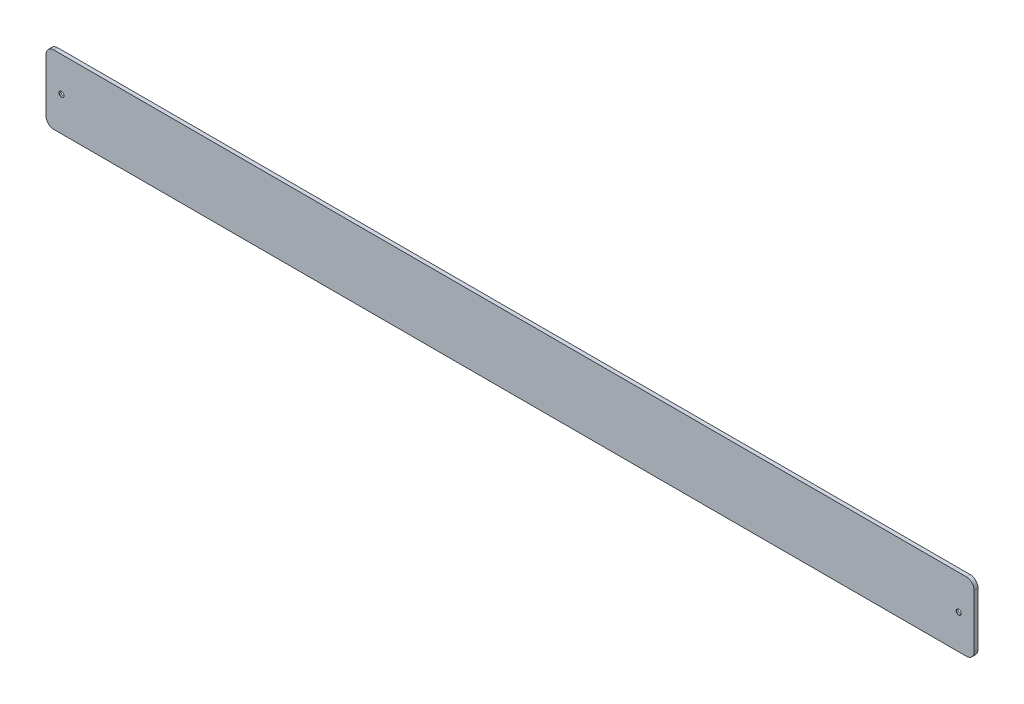
from build123d import *

# Parameters (mm, degrees)
BOSS_EXTRU_1_DEPTH                         = 5
D_GAGEMENT_M61_D                           = 6.6
CHAMBRAGE_POUR_VIS_T_TE_RONDE_BOMB_2_COUNT = 2
CHAMBRAGE_POUR_VIS_T_TE_RONDE_BOMB_2_PITCH = 1160.000013464


with BuildPart() as part:
    # Esquisse1 → Boss.-Extru.1 (new body)
    with BuildSketch(Plane.XY):
        with BuildLine():
            Line((-1067.280483871, -44.5), (112.719516129, -44.5))
            ThreePointArc((112.719516129, -44.5), (119.790583941, -41.571067812), (122.719516129, -34.5))
            Line((122.719516129, -34.5), (122.719516129, 34.5))
            ThreePointArc((122.719516129, 34.5), (119.790583941, 41.571067812), (112.719516129, 44.5))
            Line((112.719516129, 44.5), (-1067.280483871, 44.5))
            ThreePointArc((-1067.280483871, 44.5), (-1074.351551683, 41.571067812), (-1077.280483871, 34.5))
            Line((-1077.280483871, 34.5), (-1077.280483871, -34.5))
            ThreePointArc((-1077.280483871, -34.5), (-1074.351551683, -41.571067812), (-1067.280483871, -44.5))
        make_face()
    extrude(amount=BOSS_EXTRU_1_DEPTH)

    # Dégagement M61 (through all)
    with Locations(Plane.XY.offset(5)):
        with Locations((-1057.280483871, -0.176736788), (102.719516129, 0)):
            Hole(D_GAGEMENT_M61_D / 2)

    # Esquisse4 → Chambrage pour vis à tête ronde bombée M61 (revolve, cut)
    with BuildSketch(Plane.YZ.offset(102.719516129)):
        Polygon((0, 0), (0, 5), (3.3, 5), (3.3, 4.625), (3.325, 4.6), (6.5, 4.6), (6.5, 0), align=None)
    chambrage_pour_vis_t_te_ronde_bomb_e_m = revolve(axis=Axis((102.719516129, 0, -6.35), (0, 0, 1)), mode=Mode.SUBTRACT)

    # Chambrage pour vis _ t_te ronde bomb 2: Chambrage pour vis à tête ronde bombée M61 ×2
    with Locations(*[Vector(-0.999999988393322, -0.00015235929857570504, 0) * (i * CHAMBRAGE_POUR_VIS_T_TE_RONDE_BOMB_2_PITCH) for i in range(1, CHAMBRAGE_POUR_VIS_T_TE_RONDE_BOMB_2_COUNT)]):
        add(chambrage_pour_vis_t_te_ronde_bomb_e_m, mode=Mode.SUBTRACT)


solid = part.part
